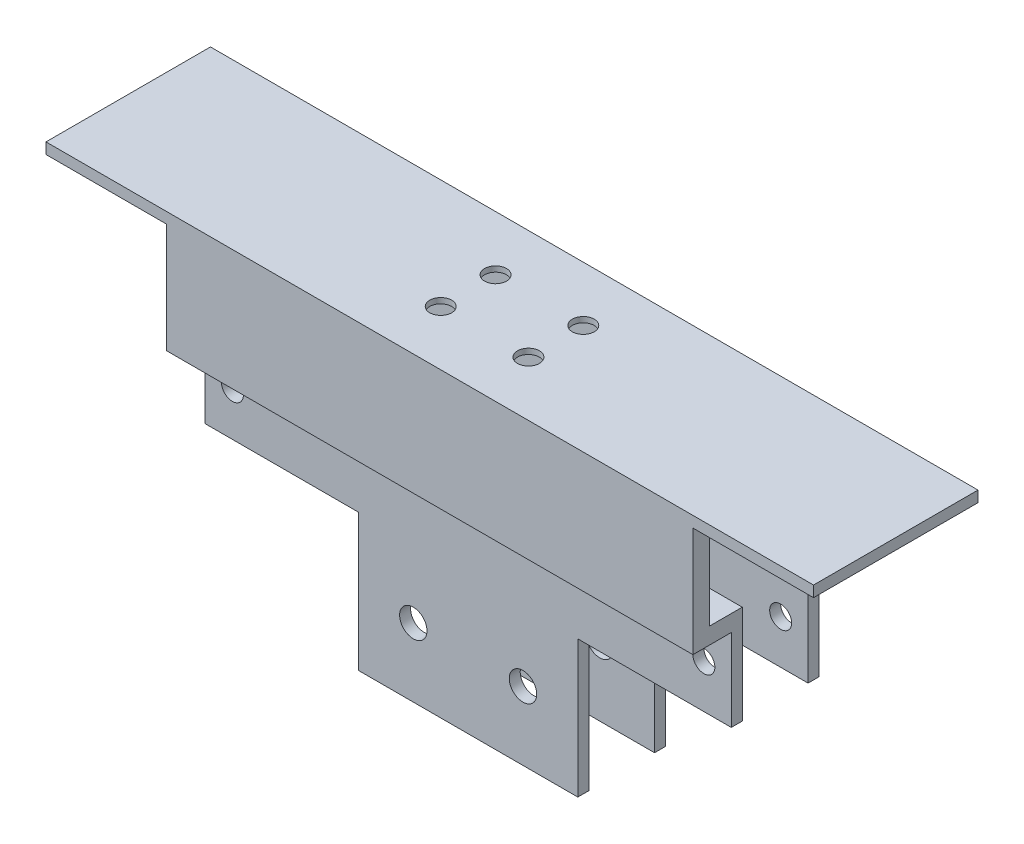
from build123d import *

# Parameters (mm, degrees)
TOP_DEPTH          = 30
PROFILE_3_W        = 96
PROFILE_3_H        = 17
SIDE_DEPTH         = 3
PROFILE_6_W        = 96
PROFILE_6_H        = 3
BEND_DEPTH         = 9
SCREWPLATE_START   = -7
PROFILE_7_R        = 2.5
PROFILE_7_R_2      = 2
SCREWPLATE_DEPTH   = 2
SIDE2_START        = -30
PROFILE_8_W        = 96
PROFILE_8_H        = 17
SIDE2_DEPTH        = 3
BEND2_START        = -30
PROFILE_9_W        = 96
PROFILE_9_H        = 3
BEND2_DEPTH        = 9
SCREWPLATE2_START  = -21
PROFILE_10_R       = 2.5
PROFILE_10_R_2     = 2
SCREWPLATE2_DEPTH  = 2
SKETCH3_R          = 2
CUT_EXTRUDE4_DEPTH = 2
CUT_EXTRUDE5_START = -1
SKETCH3_3_R        = 4
SKETCH3_3_R_2      = 2
CUT_EXTRUDE5_DEPTH = 1


with BuildPart() as part:
    # Profile → Top (new body)
    with BuildSketch(Plane.XY):
        Polygon((97.259067876, 0), (87.259067876, 0), (-32.740932124, 0), (-42.740932124, 0), (-42.740932124, 2), (97.259067876, 2), align=None)
    extrude(amount=-TOP_DEPTH)

    # Profile<3> → Side (add)
    with BuildSketch(Plane.XY):
        with Locations((27.259067876, -8.5)):
            Rectangle(PROFILE_3_W, PROFILE_3_H)
    extrude(amount=-SIDE_DEPTH)

    # Profile<6> → Bend (add)
    with BuildSketch(Plane.XY):
        with Locations((27.259067876, -18.5)):
            Rectangle(PROFILE_6_W, PROFILE_6_H)
    extrude(amount=-BEND_DEPTH)

    # Profile<7> → ScrewPlate (add)
    with BuildSketch(Plane.XY.offset(SCREWPLATE_START)):
        Polygon((75.259067876, -20), (-20.740932124, -20), (-20.740932124, -35), (7.259067876, -35), (7.259067876, -60), (27.259067876, -60), (47.259067876, -60), (47.259067876, -35), (75.259067876, -35), align=None)
        with Locations((17.259067876, -47.5)):
            Circle(PROFILE_7_R, mode=Mode.SUBTRACT)
        with Locations((37.259067876, -47.5)):
            Circle(PROFILE_7_R, mode=Mode.SUBTRACT)
        with Locations((-15.740932124, -27)):
            Circle(PROFILE_7_R_2, mode=Mode.SUBTRACT)
        with Locations((70.259067876, -27)):
            Circle(PROFILE_7_R_2, mode=Mode.SUBTRACT)
    extrude(amount=-SCREWPLATE_DEPTH)

    # Profile<8> → Side2 (add)
    with BuildSketch(Plane.XY.offset(SIDE2_START)):
        with Locations((27.259067876, -8.5)):
            Rectangle(PROFILE_8_W, PROFILE_8_H)
    extrude(amount=SIDE2_DEPTH)

    # Profile<9> → Bend2 (add)
    with BuildSketch(Plane.XY.offset(BEND2_START)):
        with Locations((27.259067876, -18.5)):
            Rectangle(PROFILE_9_W, PROFILE_9_H)
    extrude(amount=BEND2_DEPTH)

    # Profile<10> → ScrewPlate2 (add)
    with BuildSketch(Plane.XY.offset(SCREWPLATE2_START)):
        Polygon((75.259067876, -20), (-20.740932124, -20), (-20.740932124, -35), (7.259067876, -35), (7.259067876, -60), (27.259067876, -60), (47.259067876, -60), (47.259067876, -35), (75.259067876, -35), align=None)
        with Locations((17.259067876, -47.5)):
            Circle(PROFILE_10_R, mode=Mode.SUBTRACT)
        with Locations((37.259067876, -47.5)):
            Circle(PROFILE_10_R, mode=Mode.SUBTRACT)
        with Locations((-15.740932124, -27)):
            Circle(PROFILE_10_R_2, mode=Mode.SUBTRACT)
        with Locations((70.259067876, -27)):
            Circle(PROFILE_10_R_2, mode=Mode.SUBTRACT)
    extrude(amount=-SCREWPLATE2_DEPTH)

    # Sketch3 → Cut-Extrude4 (cut)
    with BuildSketch(Plane(origin=(0, 2, 0), x_dir=(1, 0, 0), z_dir=(0, 1, 0))):
        with Locations(Location((19.259067876, 20, 0), (0, 0, 270))):
            Circle(SKETCH3_R)
        with Locations(Location((35.259067876, 20, 0), (0, 0, 270))):
            Circle(SKETCH3_R)
        with Locations(Location((35.259067876, 10, 0), (0, 0, 270))):
            Circle(SKETCH3_R)
        with Locations(Location((19.259067876, 10, 0), (0, 0, 270))):
            Circle(SKETCH3_R)
    extrude(amount=-CUT_EXTRUDE4_DEPTH, mode=Mode.SUBTRACT)

    # Sketch3<3> → Cut-Extrude5 (cut)
    # profile 1 of 4: a face of its own
    with BuildSketch(Plane(origin=(0, 2, 0), x_dir=(1, 0, 0), z_dir=(0, 1, 0)).offset(CUT_EXTRUDE5_START)):
        with Locations(Location((19.259067876, 20, 0), (0, 0, 270))):
            Circle(SKETCH3_3_R)
        with Locations(Location((19.259067876, 20, 0), (0, 0, 270))):
            Circle(SKETCH3_3_R_2, mode=Mode.SUBTRACT)
    # profile 2 of 4: a face of its own
    with BuildSketch(Plane(origin=(0, 2, 0), x_dir=(1, 0, 0), z_dir=(0, 1, 0)).offset(CUT_EXTRUDE5_START)):
        with Locations(Location((35.259067876, 20, 0), (0, 0, 270))):
            Circle(SKETCH3_3_R)
        with Locations(Location((35.259067876, 20, 0), (0, 0, 270))):
            Circle(SKETCH3_3_R_2, mode=Mode.SUBTRACT)
    # profile 3 of 4: a face of its own
    with BuildSketch(Plane(origin=(0, 2, 0), x_dir=(1, 0, 0), z_dir=(0, 1, 0)).offset(CUT_EXTRUDE5_START)):
        with Locations(Location((35.259067876, 10, 0), (0, 0, 270))):
            Circle(SKETCH3_3_R)
        with Locations(Location((35.259067876, 10, 0), (0, 0, 270))):
            Circle(SKETCH3_3_R_2, mode=Mode.SUBTRACT)
    # profile 4 of 4: a face of its own
    with BuildSketch(Plane(origin=(0, 2, 0), x_dir=(1, 0, 0), z_dir=(0, 1, 0)).offset(CUT_EXTRUDE5_START)):
        with Locations(Location((19.259067876, 10, 0), (0, 0, 270))):
            Circle(SKETCH3_3_R)
        with Locations(Location((19.259067876, 10, 0), (0, 0, 270))):
            Circle(SKETCH3_3_R_2, mode=Mode.SUBTRACT)
    extrude(amount=-CUT_EXTRUDE5_DEPTH, mode=Mode.SUBTRACT)


solid = part.part
